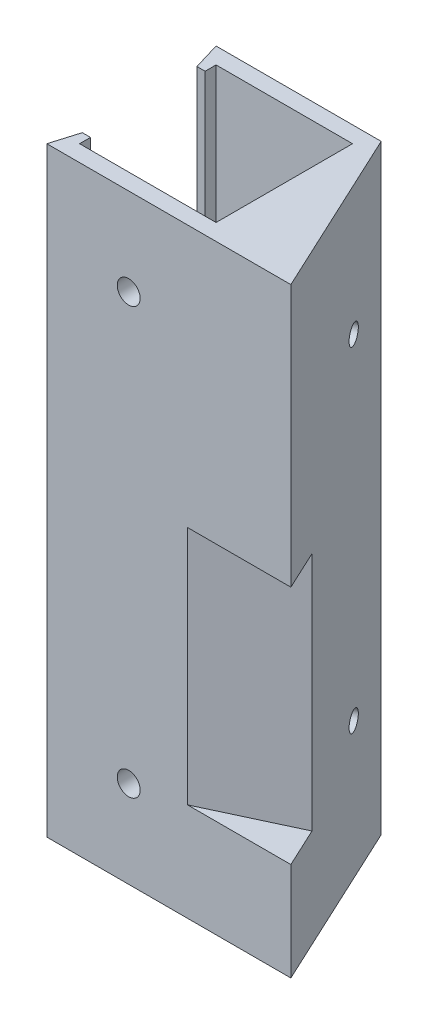
from build123d import *

# Parameters (mm, degrees)
EXTRUDE_1_DEPTH      = 110
SKETCH_2_W           = 8
SKETCH_2_H           = 44
CUT_EXTRUDE_3_DEPTH  = 110
CUT_EXTRUDE_4_DEPTH  = 134.373777696
SKETCH_4_R           = 1.75
CUT_EXTRUDE_6_DEPTH  = 10
CUT_EXTRUDE_START    = -2.5
CUT_EXTRUDE_11_DEPTH = 10
SKETCH_6_R           = 2.1
CUT_EXTRUDE_13_DEPTH = 133.388375153


with BuildPart() as part:
    # Эскиз1 → Бобышка-Вытянуть1 (new body)
    with BuildSketch(Plane(origin=(0, 0, 0), x_dir=(1, 0, 0), z_dir=(0, 1, 0))):
        Polygon((-66.825757576, 34.969739794), (-66.825757576, 29.969739794), (-63.825757576, 29.969739794), (-63.825757576, 31.969739794), (-38.825757576, 31.969739794), (-38.825757576, 6.969739794), (-63.825757576, 6.969739794), (-63.825757576, 8.969739794), (-66.825757576, 8.969739794), (-66.825757576, 3.969739794), (-22.123470102, 3.969739794), (-36.579007505, 34.969739794), align=None)
    extrude(amount=EXTRUDE_1_DEPTH)

    # Эскиз2 → Вырез-Вытянуть3 (cut)
    with BuildSketch(Plane(origin=(-16.651582729, 0, 7.764760547), x_dir=(-0.42261826174069383, 0, -0.9063077870366526), z_dir=(0.9063077870366527, 0, -0.4226182617406939))):
        with Locations((16.947588566, 40)):
            Rectangle(SKETCH_2_W, SKETCH_2_H)
    extrude(amount=-CUT_EXTRUDE_3_DEPTH, mode=Mode.SUBTRACT)

    # Эскиз3 → Вырез-Вытянуть4 (cut, through all)
    with BuildSketch(Plane.XZ):
        Polygon((-66.825757576, -3.969739794), (-65.325757576, -8.969739794), (-66.825757576, -8.969739794), align=None)
        Polygon((-66.825757576, -29.969739794), (-66.825757576, -34.969739794), (-65.325757576, -29.969739794), align=None)
    extrude(amount=-CUT_EXTRUDE_4_DEPTH, mode=Mode.SUBTRACT)

    # Эскиз4 → Вырез-Вытянуть6 (cut)
    with BuildSketch(Plane(origin=(-16.651582729, 0, 7.764760547), x_dir=(-0.42261826174069383, 0, -0.9063077870366526), z_dir=(0.9063077870366527, 0, -0.4226182617406939))):
        with Locations((36.747588566, 86.3)):
            Circle(SKETCH_4_R)
        with Locations((36.747588566, 25)):
            Circle(SKETCH_4_R)
    extrude(amount=-CUT_EXTRUDE_6_DEPTH, mode=Mode.SUBTRACT)

    # Эскиз5 → Вырез-Вытянуть11 (cut)
    with BuildSketch(Plane(origin=(-16.651582729, 0, 7.764760547), x_dir=(-0.42261826174069383, 0, -0.9063077870366526), z_dir=(0.9063077870366527, 0, -0.4226182617406939)).offset(CUT_EXTRUDE_START)):
        Polygon((40.78904045, 86.3), (38.768314508, 89.8), (34.726862624, 89.8), (32.706136682, 86.3), (34.726862624, 82.8), (38.768314508, 82.8), align=None)
        Polygon((40.78904045, 25), (38.768314508, 28.5), (34.726862624, 28.5), (32.706136682, 25), (34.726862624, 21.5), (38.768314508, 21.5), align=None)
    extrude(amount=-CUT_EXTRUDE_11_DEPTH, mode=Mode.SUBTRACT)

    # Эскиз6 → Вырез-Вытянуть13 (cut, through all)
    with BuildSketch(Plane.XY.offset(-3.969739794)):
        with Locations((-51.825757576, 94)):
            Circle(SKETCH_6_R)
        with Locations((-51.825757576, 16)):
            Circle(SKETCH_6_R)
    extrude(amount=-CUT_EXTRUDE_13_DEPTH, mode=Mode.SUBTRACT)


solid = part.part
